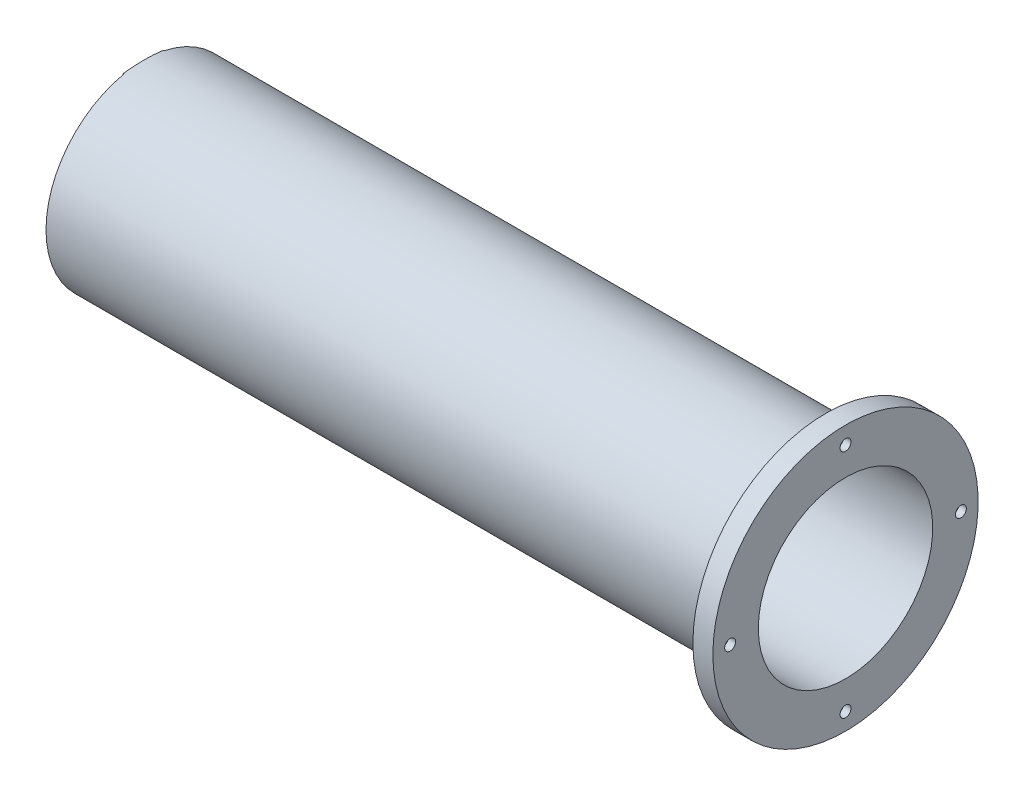
from build123d import *

# Parameters (mm, degrees)
ESBO_O2_R                = 2
RESSALTO_EXTRUS_O1_DEPTH = 5.5
ESBO_O3_R                = 33.530734639
ESBO_O3_R_2              = 27
CORTE_EXTRUS_O1_DEPTH    = 11
ESBO_O4_R                = 3.25
CORTE_EXTRUS_O3_DEPTH    = 3.5
CORTE_EXTRUS_O4_DEPTH    = 205.13414707
PADR_OCIRCULAR7_COUNT    = 4


with BuildPart() as part:
    # Esboço1 → revolução (revolve)
    with BuildSketch(Plane.XY, mode=Mode.PRIVATE) as revolu_o_sk:
        with BuildLine():
            Line((-63.834530413, 0), (-63.834530413, 27))
            Line((-63.834530413, 27), (123.665469587, 27))
            Line((123.665469587, 27), (123.665469587, 36.5))
            Line((123.665469587, 36.5), (129.165469587, 36.5))
            Line((129.165469587, 36.5), (129.165469587, 24))
            Line((129.165469587, 24), (-55.834512047, 24))
            ThreePointArc((-55.834512047, 24), (-59.370057826, 22.535540399), (-60.834530413, 19))
            Line((-60.834530413, 19), (-60.834530413, 0))
            Line((-60.834530413, 0), (-63.834530413, 0))
        make_face()
    revolve(revolu_o_sk.sketch.rotate(Axis((-88.99, 0, 0), (1, 0, 0)), 90), axis=Axis((-88.99, 0, 0), (1, 0, 0)))

    # Esboço4 → Corte-extrusão3 (cut)
    with BuildSketch(Plane.ZY.offset(-123.665469587)):
        with Locations((0, 31.75)):
            Circle(ESBO_O4_R)
    corte_extrus_o3 = extrude(amount=-CORTE_EXTRUS_O3_DEPTH, mode=Mode.SUBTRACT)

    # Esboço4<3> → Corte-extrusão4 (cut, through all)
    with BuildSketch(Plane.ZY.offset(-123.665469587)):
        with BuildLine():
            ThreePointArc((0, 33.25), (-1.5, 31.75), (0, 30.25))
            Line((0, 30.25), (0, 33.25))
        make_face()
        with BuildLine():
            Line((0, 33.25), (0, 30.25))
            ThreePointArc((0, 30.25), (1.060660172, 30.689339828), (1.5, 31.75))
            ThreePointArc((1.5, 31.75), (1.060660172, 32.810660172), (0, 33.25))
        make_face()
    corte_extrus_o4 = extrude(amount=-CORTE_EXTRUS_O4_DEPTH, mode=Mode.SUBTRACT)

    # PadrãoCircular7: Corte-extrusão3, Corte-extrusão4 ×4 about axis
    padr_ocircular7_axis = Axis((0, 0, 0), (1, 0, 0))
    add([corte_extrus_o3.rotate(padr_ocircular7_axis, i * 360 / PADR_OCIRCULAR7_COUNT) for i in range(1, PADR_OCIRCULAR7_COUNT)], mode=Mode.SUBTRACT)
    add([corte_extrus_o4.rotate(padr_ocircular7_axis, i * 360 / PADR_OCIRCULAR7_COUNT) for i in range(1, PADR_OCIRCULAR7_COUNT)], mode=Mode.SUBTRACT)


with BuildPart() as body_2:
    # Esboço2 → Ressalto-extrusão1 (new, symmetric)
    with BuildSketch(Plane.XY):
        Polygon((-63.834530413, 27), (-73.834530413, 0), (-63.834530413, -27), align=None)
        with Locations((-68.834530413, 0)):
            Circle(ESBO_O2_R, mode=Mode.SUBTRACT)
    extrude(amount=RESSALTO_EXTRUS_O1_DEPTH, both=True)

    # Esboço3 → Corte-extrusão1 (cut)
    with BuildSketch(Plane.ZY.offset(63.834530413)):
        Circle(ESBO_O3_R)
        Circle(ESBO_O3_R_2, mode=Mode.SUBTRACT)
    extrude(amount=CORTE_EXTRUS_O1_DEPTH, mode=Mode.SUBTRACT)


with BuildPart() as part_1:
    add(part.part)

    # Combinar1: union body 2
    add(body_2.part)


solid = part_1.part
